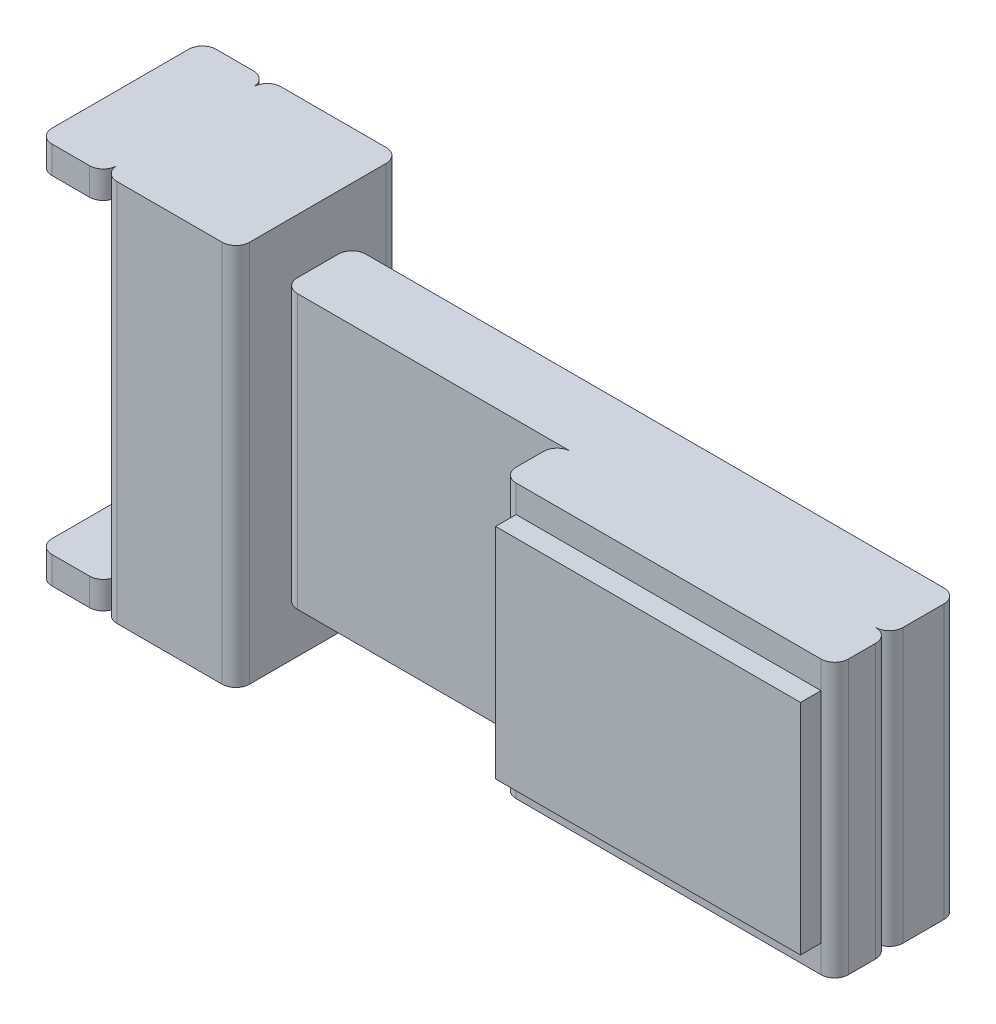
from build123d import *

# Parameters (mm, degrees)
SLIDER_START          = -14
SLIDER_DEPTH          = 28
RAIL_LIP_TOP_START    = 12
RAIL_LIP_TOP_DEPTH    = 2
RAIL_LIP_BOTTOM_START = -14
RAIL_LIP_BOTTOM_DEPTH = 2
FINGER_START          = -10
FINGER_DEPTH          = 20
JAW_START             = -10
JAW_DEPTH             = 20
GRIP_PAD_START        = -8
SK_6_W                = 22.3
SK_6_H                = 1.5
GRIP_PAD_DEPTH        = 16


with BuildPart() as part:
    # SK_1 → Slider (new body)
    with BuildSketch(Plane(origin=(0, 0, 0), x_dir=(1, 0, 0), z_dir=(0, 1, 0)).offset(SLIDER_START)):
        with BuildLine():
            Line((-8.7, -6), (-1, -6))
            ThreePointArc((-1, -6), (-0.292893219, -5.707106781), (0, -5))
            Line((0, -5), (0, 5))
            ThreePointArc((0, 5), (-0.292893219, 5.707106781), (-1, 6))
            Line((-1, 6), (-8.7, 6))
            ThreePointArc((-8.7, 6), (-9.407106781, 5.707106781), (-9.7, 5))
            Line((-9.7, 5), (-9.7, -5))
            ThreePointArc((-9.7, -5), (-9.407106781, -5.707106781), (-8.7, -6))
        make_face()
    extrude(amount=SLIDER_DEPTH)

    # SK_2 → Rail_Lip_Top (add)
    with BuildSketch(Plane(origin=(0, 0, 0), x_dir=(1, 0, 0), z_dir=(0, 1, 0)).offset(RAIL_LIP_TOP_START)):
        with BuildLine():
            Line((-13.45, -6), (-10.7, -6))
            ThreePointArc((-10.7, -6), (-9.992893219, -5.707106781), (-9.7, -5))
            Line((-9.7, -5), (-9.7, 5))
            ThreePointArc((-9.7, 5), (-9.992893219, 5.707106781), (-10.7, 6))
            Line((-10.7, 6), (-13.45, 6))
            ThreePointArc((-13.45, 6), (-14.157106781, 5.707106781), (-14.45, 5))
            Line((-14.45, 5), (-14.45, -5))
            ThreePointArc((-14.45, -5), (-14.157106781, -5.707106781), (-13.45, -6))
        make_face()
    extrude(amount=RAIL_LIP_TOP_DEPTH)

    # SK_3 → Rail_Lip_Bottom (add)
    with BuildSketch(Plane(origin=(0, 0, 0), x_dir=(1, 0, 0), z_dir=(0, 1, 0)).offset(RAIL_LIP_BOTTOM_START)):
        with BuildLine():
            Line((-13.45, -6), (-10.7, -6))
            ThreePointArc((-10.7, -6), (-9.992893219, -5.707106781), (-9.7, -5))
            Line((-9.7, -5), (-9.7, 5))
            ThreePointArc((-9.7, 5), (-9.992893219, 5.707106781), (-10.7, 6))
            Line((-10.7, 6), (-13.45, 6))
            ThreePointArc((-13.45, 6), (-14.157106781, 5.707106781), (-14.45, 5))
            Line((-14.45, 5), (-14.45, -5))
            ThreePointArc((-14.45, -5), (-14.157106781, -5.707106781), (-13.45, -6))
        make_face()
    extrude(amount=RAIL_LIP_BOTTOM_DEPTH)

    # SK_4 → Finger (add)
    with BuildSketch(Plane(origin=(0, 0, 0), x_dir=(1, 0, 0), z_dir=(0, 1, 0)).offset(FINGER_START)):
        with BuildLine():
            Line((1, -2.5), (43.3, -2.5))
            ThreePointArc((43.3, -2.5), (44.007106781, -2.207106781), (44.3, -1.5))
            Line((44.3, -1.5), (44.3, 1.5))
            ThreePointArc((44.3, 1.5), (44.007106781, 2.207106781), (43.3, 2.5))
            Line((43.3, 2.5), (1, 2.5))
            ThreePointArc((1, 2.5), (0.292893219, 2.207106781), (0, 1.5))
            Line((0, 1.5), (0, -1.5))
            ThreePointArc((0, -1.5), (0.292893219, -2.207106781), (1, -2.5))
        make_face()
    extrude(amount=FINGER_DEPTH)

    # SK_5 → Jaw (add)
    with BuildSketch(Plane(origin=(0, 0, 0), x_dir=(1, 0, 0), z_dir=(0, 1, 0)).offset(JAW_START)):
        with BuildLine():
            Line((21, -6.5), (43.3, -6.5))
            ThreePointArc((43.3, -6.5), (44.007106781, -6.207106781), (44.3, -5.5))
            Line((44.3, -5.5), (44.3, -3.5))
            ThreePointArc((44.3, -3.5), (44.007106781, -2.792893219), (43.3, -2.5))
            Line((43.3, -2.5), (21, -2.5))
            ThreePointArc((21, -2.5), (20.292893219, -2.792893219), (20, -3.5))
            Line((20, -3.5), (20, -5.5))
            ThreePointArc((20, -5.5), (20.292893219, -6.207106781), (21, -6.5))
        make_face()
    extrude(amount=JAW_DEPTH)

    # SK_6 → Grip_Pad (add)
    with BuildSketch(Plane(origin=(0, 0, 0), x_dir=(1, 0, 0), z_dir=(0, 1, 0)).offset(GRIP_PAD_START)):
        with Locations((32.15, -7.25)):
            Rectangle(SK_6_W, SK_6_H)
    extrude(amount=GRIP_PAD_DEPTH)


solid = part.part
